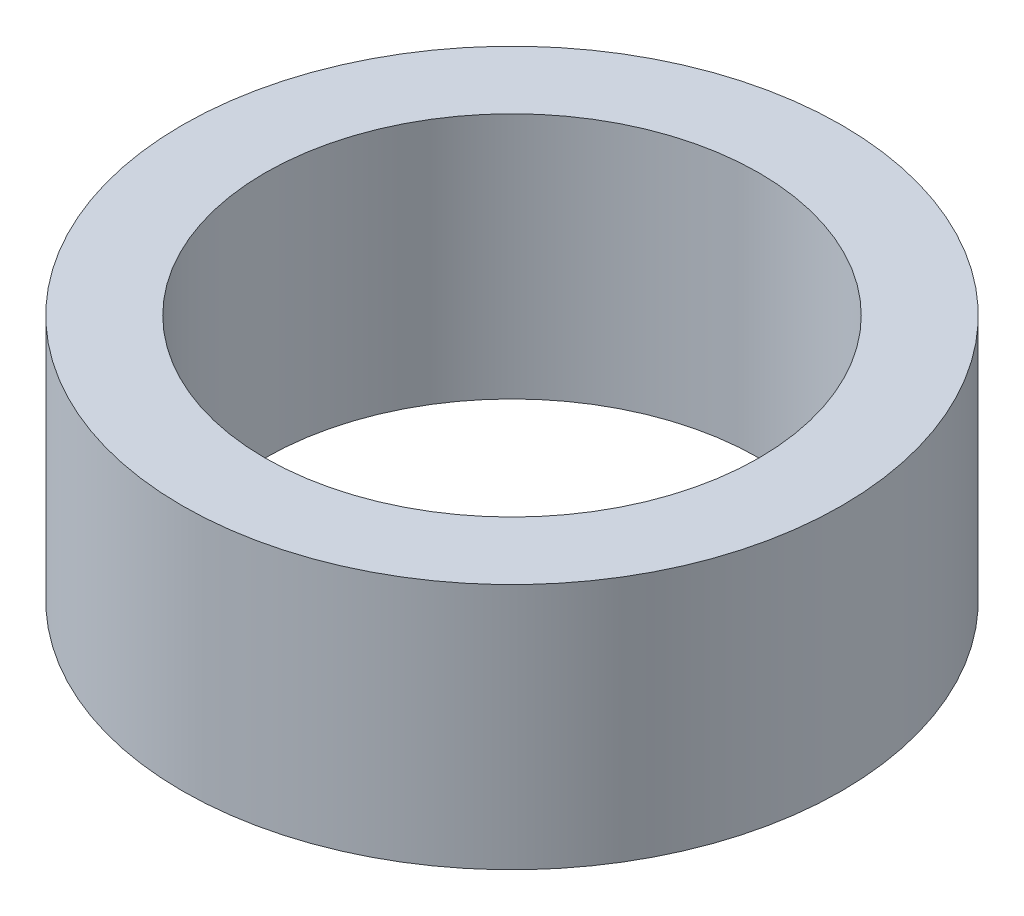
from build123d import *

# Parameters (mm, degrees)
CROQUIS1_R              = 13.35
SALIENTE_EXTRUIR3_DEPTH = 10
CROQUIS4_R              = 10
CORTAR_EXTRUIR1_DEPTH   = 12


with BuildPart() as part:
    # Croquis1 → Saliente-Extruir3 (new body)
    with BuildSketch(Plane(origin=(0, 0, 0), x_dir=(1, 0, 0), z_dir=(0, 1, 0))):
        with Locations(Location((0, 0, 0), (0, 0, 270))):
            Circle(CROQUIS1_R)
    extrude(amount=SALIENTE_EXTRUIR3_DEPTH)

    # Croquis4 → Cortar-Extruir1 (cut)
    with BuildSketch(Plane(origin=(0, 0, 0), x_dir=(1, 0, 0), z_dir=(0, 1, 0))):
        with Locations(Location((0, 0, 0), (0, 0, 270))):
            Circle(CROQUIS4_R)
    extrude(amount=CORTAR_EXTRUIR1_DEPTH, mode=Mode.SUBTRACT)


solid = part.part
